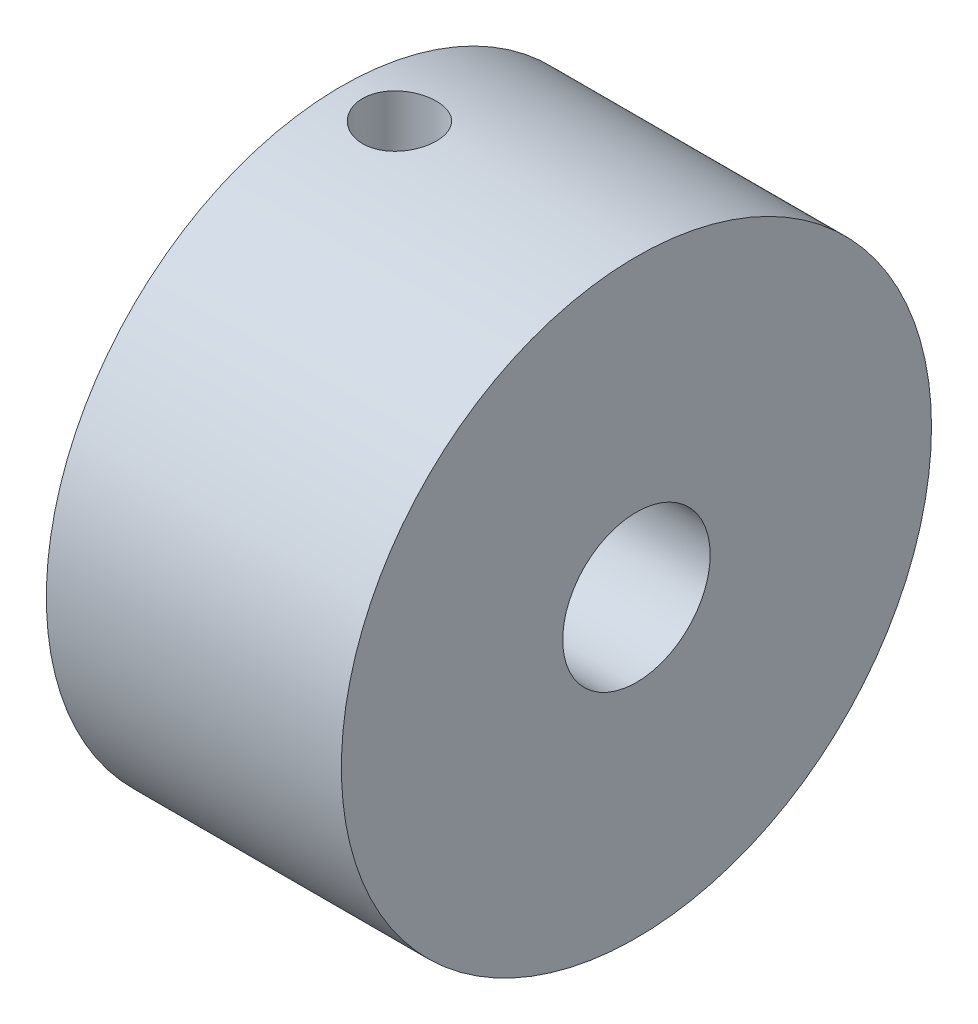
from build123d import *

# Parameters (mm, degrees)
SKETCH1_R                       = 12.7
BOSS_EXTRUDE1_DEPTH             = 12.7
SKETCH2_R                       = 3.5
CUT_EXTRUDE1_DEPTH              = 5
F_1_4_0_25_DIAMETER_HOLE1_D     = 6.35
F_1_4_0_25_DIAMETER_HOLE1_DEPTH = 10.16
F_1_4_0_25_DIAMETER_HOLE1_TIP   = 1.907732465


with BuildPart() as part:
    # Sketch1 → Boss-Extrude1 (new body)
    with BuildSketch(Plane(origin=(0, 0, 0), x_dir=(0, 0, -1), z_dir=(1, 0, 0))):
        Circle(SKETCH1_R)
    extrude(amount=BOSS_EXTRUDE1_DEPTH)

    # Sketch2 → Cut-Extrude1 (cut)
    with BuildSketch(Plane.ZY):
        Circle(SKETCH2_R)
    extrude(amount=-CUT_EXTRUDE1_DEPTH, mode=Mode.SUBTRACT)

    # 1/4 (0.25) Diameter Hole1
    with Locations(Plane(origin=(12.7, 0, 0), x_dir=(0, 0, -1), z_dir=(1, 0, 0))):
        with Locations((0, 0)):
            Hole(F_1_4_0_25_DIAMETER_HOLE1_D / 2, depth=F_1_4_0_25_DIAMETER_HOLE1_DEPTH)
            with Locations((0, 0, -(F_1_4_0_25_DIAMETER_HOLE1_DEPTH + F_1_4_0_25_DIAMETER_HOLE1_TIP / 2))):  # 118° drill point
                Cone(0, F_1_4_0_25_DIAMETER_HOLE1_D / 2, F_1_4_0_25_DIAMETER_HOLE1_TIP, mode=Mode.SUBTRACT)

    # Sketch7 → 1/8 (0.125) Diameter Hole1 (revolve, cut)
    with BuildSketch(Plane(origin=(2.5, 0, 0), x_dir=(0, 0, -1), z_dir=(1, 0, 0))):
        Polygon((0, 0), (0, 16.193866233), (1.5875, 15.24), (1.5875, 0), align=None)
    revolve(axis=Axis((2.5, -6.35, 0), (0, 1, 0)), mode=Mode.SUBTRACT)


solid = part.part
